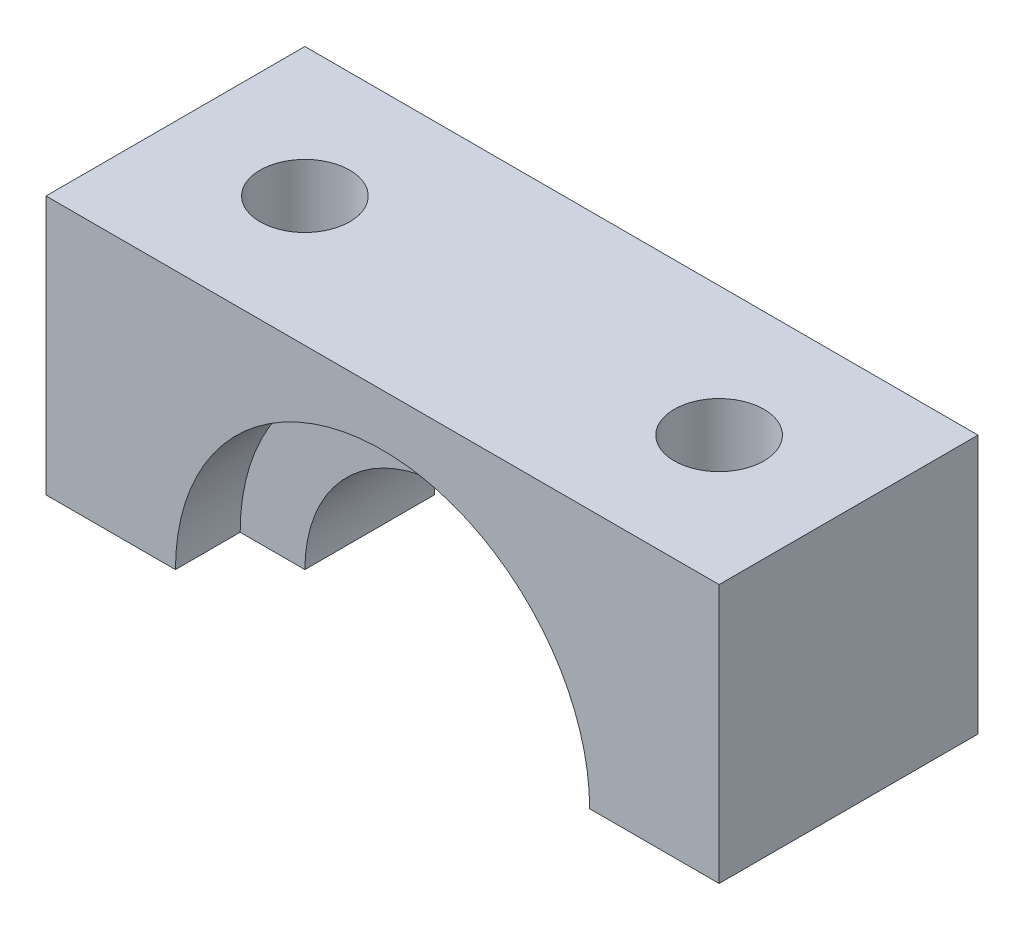
from build123d import *

# Parameters (mm, degrees)
RESSALTO_EXTRUS_O1_DEPTH = 2.5
RESSALTO_EXTRUS_O2_DEPTH = 5
ESBO_O2_R                = 1.730913938
CORTE_EXTRUS_O1_DEPTH    = 15


with BuildPart() as part:
    # Esboço1 → Ressalto-extrusão1 (new, symmetric)
    with BuildSketch(Plane.XY):
        with BuildLine():
            Line((-5.5, 0), (-13, 0))
            Line((-13, 0), (-13, 10))
            Line((-13, 10), (13, 10))
            Line((13, 10), (13, 0))
            Line((13, 0), (5.5, 0))
            ThreePointArc((5.5, 0), (0, 5.5), (-5.5, 0))
        make_face()
    extrude(amount=RESSALTO_EXTRUS_O1_DEPTH, both=True)

    # Esboço3 → Ressalto-extrusão2 (add, symmetric)
    with BuildSketch(Plane.XY):
        with BuildLine():
            Line((-13, 10), (-13, 0))
            Line((-13, 0), (-8, 0))
            ThreePointArc((-8, 0), (0, 8), (8, 0))
            Line((8, 0), (13, 0))
            Line((13, 0), (13, 10))
            Line((13, 10), (-13, 10))
        make_face()
    extrude(amount=RESSALTO_EXTRUS_O2_DEPTH, both=True)

    # Esboço2 → Corte-extrusão1 (cut)
    with BuildSketch(Plane.XZ):
        with Locations((-8, 0)):
            Circle(ESBO_O2_R)
        with Locations((8, 0)):
            Circle(ESBO_O2_R)
    extrude(amount=-CORTE_EXTRUS_O1_DEPTH, mode=Mode.SUBTRACT)


solid = part.part
